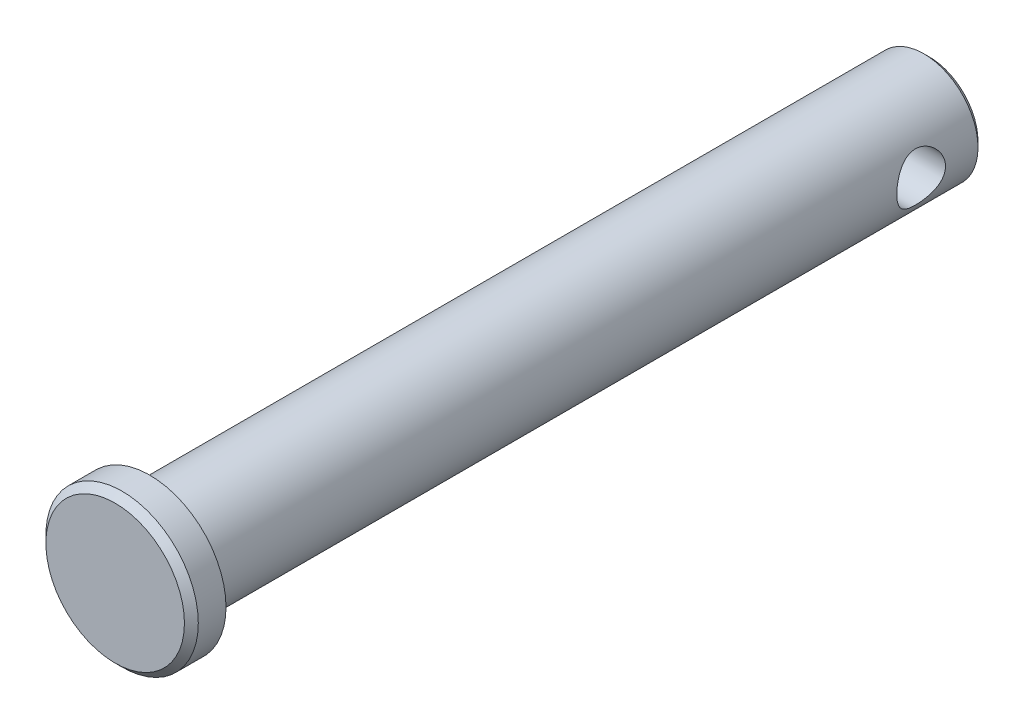
from build123d import *

# Parameters (mm, degrees)
SKETCH1_R           = 3.96875
EXTRUDE1_DEPTH      = 28.575
SKETCH2_R           = 5.588
EXTRUDE2_DEPTH      = 2.54
CHAMFER1_SIZE       = 0.508
EXTRUDE3_DEPTH      = 33.102877021
EXTRUDE3_DEPTH_BACK = 33.102877021
SKETCH3_R           = 1.7859375
CHAMFER2_SIZE       = 0.396875


with BuildPart() as part:
    # Sketch1 → Extrude1 (new, symmetric)
    with BuildSketch(Plane.XY):
        Circle(SKETCH1_R)
    extrude(amount=EXTRUDE1_DEPTH, both=True)

    # Sketch2 → Extrude2 (add)
    with BuildSketch(Plane.XY.offset(28.575)):
        Circle(SKETCH2_R)
    extrude(amount=EXTRUDE2_DEPTH)

    # Chamfer1
    chamfer1_edges = [part.edges().sort_by_distance(p)[0] for p in [
        (-5.588, 0, 31.115),
    ]]
    chamfer(chamfer1_edges, length=CHAMFER1_SIZE)

    # Sketch3 → Extrude3 (cut, two sides: drawn at the far end of the back side and taken through both)
    with BuildSketch(Plane(origin=(0, 0, 0), x_dir=(0, 0, -1), z_dir=(1, 0, 0)).offset(-EXTRUDE3_DEPTH_BACK)):
        with Locations(Location((24.0109375, 0, 0), (0, 0, 179.999999999))):
            Circle(SKETCH3_R)
    extrude(amount=EXTRUDE3_DEPTH + EXTRUDE3_DEPTH_BACK, mode=Mode.SUBTRACT)

    # Chamfer2
    chamfer2_edges = [part.edges().sort_by_distance(p)[0] for p in [
        (-3.96875, 0, -28.575),
    ]]
    chamfer(chamfer2_edges, length=CHAMFER2_SIZE)


solid = part.part
